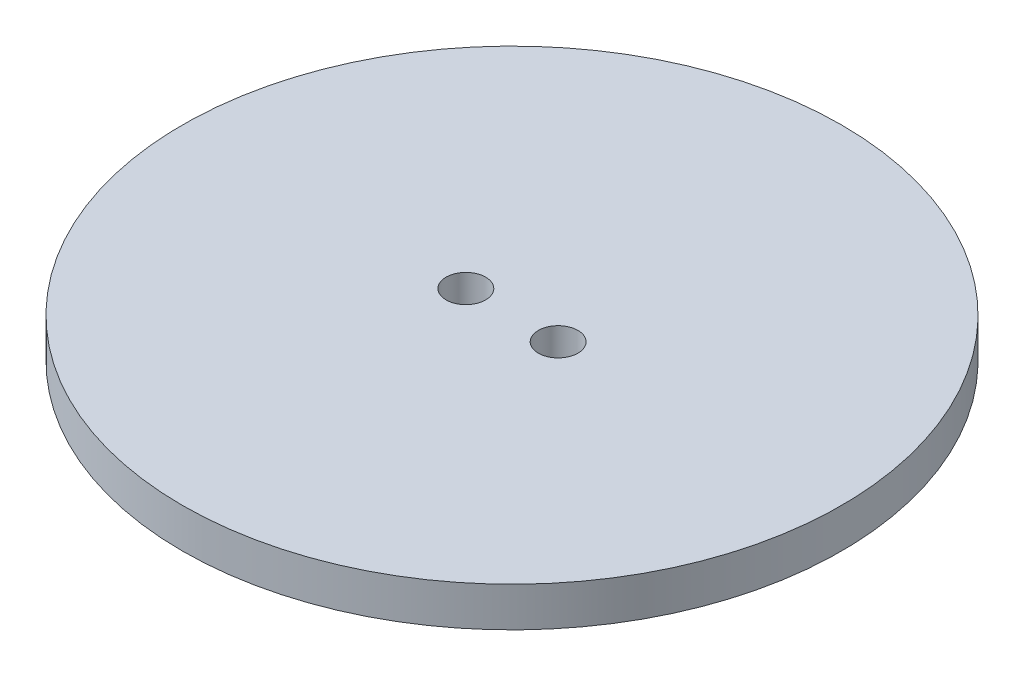
from build123d import *

# Parameters (mm, degrees)
ESQUISSE1_R        = 25
ESQUISSE1_R_2      = 1.5
BOSS_EXTRU_1_DEPTH = 3


with BuildPart() as part:
    # Esquisse1 → Boss.-Extru.1 (new body)
    with BuildSketch(Plane(origin=(0, 0, 0), x_dir=(1, 0, 0), z_dir=(0, 1, 0))):
        with Locations(Location((0, 0, 0), (0, 0, 270))):
            Circle(ESQUISSE1_R)
        with Locations(Location((-3.5, 0, 0), (0, 0, 270))):
            Circle(ESQUISSE1_R_2, mode=Mode.SUBTRACT)
        with Locations(Location((3.5, 0, 0), (0, 0, 270))):
            Circle(ESQUISSE1_R_2, mode=Mode.SUBTRACT)
    extrude(amount=BOSS_EXTRU_1_DEPTH)


solid = part.part
